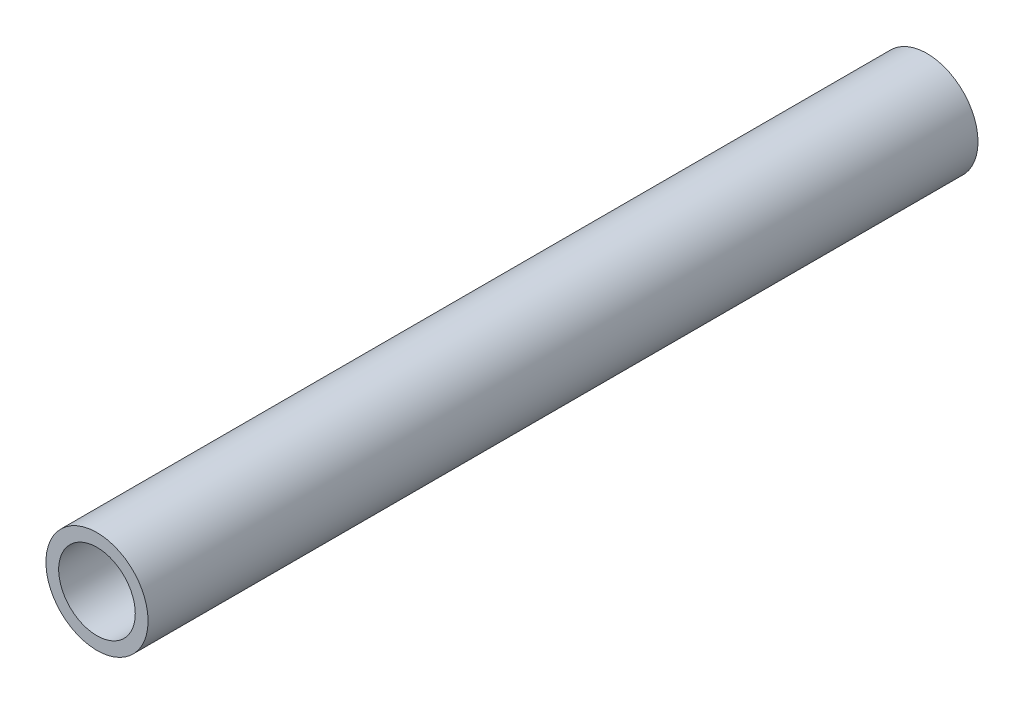
from build123d import *

# Parameters (mm, degrees)
SKETCH_1_R      = 8
SKETCH_1_R_2    = 6
EXTRUDE_1_DEPTH = 130


with BuildPart() as part:
    # 草图1 → 凸台-拉伸1 (new body)
    with BuildSketch(Plane.XY):
        Circle(SKETCH_1_R)
        Circle(SKETCH_1_R_2, mode=Mode.SUBTRACT)
    extrude(amount=EXTRUDE_1_DEPTH)


solid = part.part
